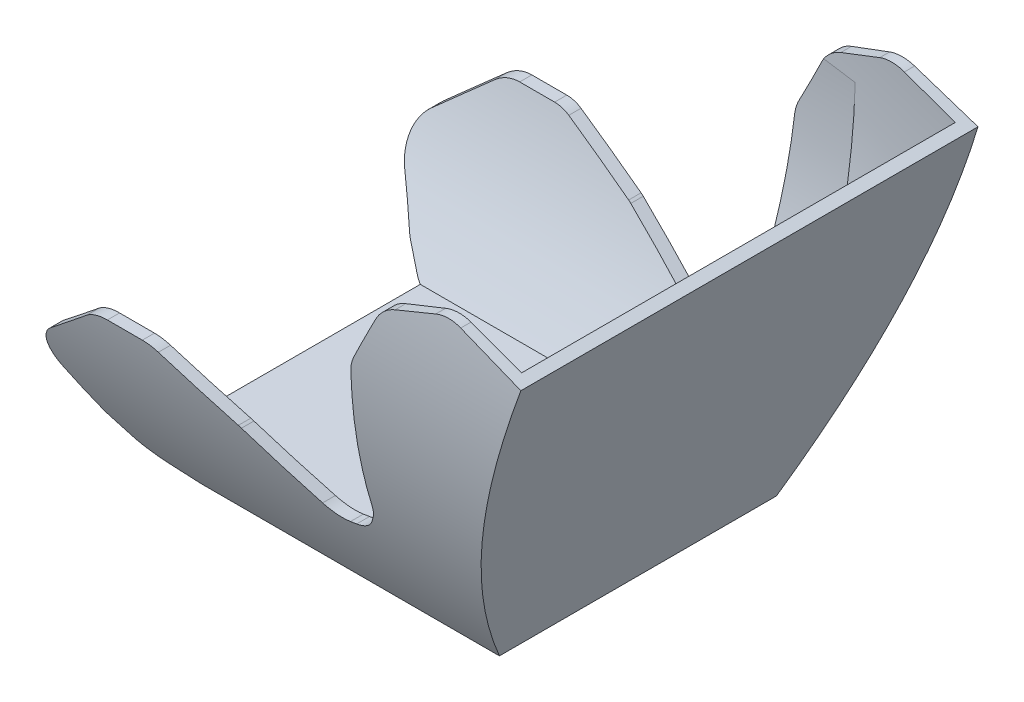
from build123d import *

# Parameters (mm, degrees)
Y_KSEKLIK_EKSTR_ZYON1_DEPTH = 250
KES_EKSTR_ZYON13_DEPTH      = 500
KES_EKSTR_ZYON14_DEPTH      = 1000
IZIM15_R                    = 5
Y_KSEKLIK_EKSTR_ZYON4_DEPTH = 8
KES_EKSTR_ZYON16_START      = -10
KES_EKSTR_ZYON16_DEPTH      = 398


with BuildPart() as part:
    # Çizim2 → Yükseklik-Ekstrüzyon1 (new, symmetric)
    with BuildSketch(Plane.XY):
        with BuildLine():
            Line((-251.598347714, 0), (0, 0))
            Line((0, 0), (94.770919234, 280.870869409))
            Line((94.770919234, 280.870869409), (42.271596492, 300.037816277))
            ThreePointArc((42.271596492, 300.037816277), (31.625623132, 301.855057422), (21.025984571, 299.784604201))
            Line((21.025984571, 299.784604201), (-12.44122247, 286.653935956))
            ThreePointArc((-12.44122247, 286.653935956), (-21.685117037, 280.905727888), (-28.269396883, 272.237467295))
            Line((-28.269396883, 272.237467295), (-47.268412194, 234.572083159))
            ThreePointArc((-47.268412194, 234.572083159), (-49.490308525, 228.714918742), (-50.447386388, 222.524022177))
            Line((-50.447386388, 222.524022177), (-55.990395454, 108.986552763))
            ThreePointArc((-55.990395454, 108.986552763), (-57.106750726, 102.215641855), (-59.732542728, 95.875555108))
            Line((-59.732542728, 95.875555108), (-62.512116759, 90.874386918))
            ThreePointArc((-62.512116759, 90.874386918), (-70.477702775, 81.642865284), (-81.459104145, 76.343773268))
            Line((-81.459104145, 76.343773268), (-87.335030472, 74.874983012))
            ThreePointArc((-87.335030472, 74.874983012), (-98.838790637, 74.278991376), (-109.719108658, 78.061898157))
            Line((-109.719108658, 78.061898157), (-166.235737603, 111.008804426))
            ThreePointArc((-166.235737603, 111.008804426), (-167.345789278, 111.624826846), (-168.480909755, 112.193333524))
            Line((-168.480909755, 112.193333524), (-227.9998591, 140.443369885))
            ThreePointArc((-227.9998591, 140.443369885), (-234.270789173, 142.607877162), (-240.864104601, 143.341257956))
            Line((-240.864104601, 143.341257956), (-270.544956688, 143.340747158))
            ThreePointArc((-270.544956688, 143.340747158), (-280.927841245, 141.486528141), (-290.027309538, 136.153414917))
            Line((-290.027309538, 136.153414917), (-332.246207759, 100.096901135))
            ThreePointArc((-332.246207759, 100.096901135), (-342.456224595, 81.565882872), (-337.897558117, 60.905252638))
            Line((-337.897558117, 60.905252638), (-319.153714319, 32.14205353))
            ThreePointArc((-319.153714319, 32.14205353), (-317.426252372, 29.756074883), (-315.473122783, 27.551011689))
            Line((-315.473122783, 27.551011689), (-302.684297046, 14.467253273))
            ThreePointArc((-302.684297046, 14.467253273), (-297.840926945, 10.455295678), (-292.267553772, 7.541269399))
            Line((-292.267553772, 7.541269399), (-287.337625955, 5.590773548))
            ThreePointArc((-287.337625955, 5.590773548), (-283.96923548, 4.483431985), (-280.493722449, 3.781243338))
            Line((-280.493722449, 3.781243338), (-255.791328898, 0.294463331))
            ThreePointArc((-255.791328898, 0.294463331), (-253.700001816, 0.073706377), (-251.598347714, 0))
        make_face()
    extrude(amount=Y_KSEKLIK_EKSTR_ZYON1_DEPTH, both=True)

    # Çizim13 → Kes-Ekstrüzyon13 (cut, symmetric)
    with BuildSketch(Plane(origin=(0, 0, 0), x_dir=(0, 0, -1), z_dir=(1, 0, 0))):
        Polygon((294.881715038, 462.49790849), (-269.886941457, 462.49790849), (-294.112942808, -53.818745303), (294.881715038, -53.818745303), align=None)
        with BuildLine():
            Line((117.717370471, 0), (-117.717370471, 0))
            add(Edge.make_bspline(
                [(-176.716004976, 388.305779353), (-213.790379898, 252.136745213), (-194.124168396, 122.70148543), (-117.717370471, 0)],
                knots=[0.063181562, 0.063181562, 0.063181562, 0.063181562, 1, 1, 1, 1], degree=3))
            Line((-176.716004976, 388.305779353), (176.716004976, 388.305779353))
            add(Edge.make_bspline(
                [(176.716004976, 388.305779353), (213.790379898, 252.136745214), (194.124168396, 122.70148543), (117.717370471, 0)],
                knots=[0.063181562, 0.063181562, 0.063181562, 0.063181562, 1, 1, 1, 1], degree=3))
        make_face(mode=Mode.SUBTRACT)
    extrude(amount=KES_EKSTR_ZYON13_DEPTH, both=True, mode=Mode.SUBTRACT)

    # Çizim13<3> → Kes-Ekstrüzyon14 (cut)
    with BuildSketch(Plane(origin=(0, 0, 0), x_dir=(0, 0, -1), z_dir=(1, 0, 0))):
        with BuildLine():
            Line((169.019924374, 378.305779353), (-169.019924374, 378.305779353))
            add(Edge.make_bspline(
                [(-112.133649161, 10), (-113.24578432, 11.823775225), (-115.454274312, 15.490392711), (-119.757397172, 22.816603417), (-124.946316144, 31.999559087), (-130.862064414, 43.047432937), (-138.338218725, 57.820092835), (-146.91156559, 76.363289483), (-155.968024634, 98.740969277), (-163.795789649, 121.246412315), (-172.598208489, 151.427747374), (-180.542606024, 189.48885585), (-184.419921192, 228.022624838), (-185.082491018, 259.151084736), (-184.358936213, 282.652164676), (-182.413337197, 306.312811619), (-179.24466472, 330.133106378), (-175.580266325, 350.129347559), (-172.039236622, 366.19151893), (-170.055020129, 374.284528287), (-169.019924374, 378.305779353)],
                knots=[0.080413288, 0.080413288, 0.080413288, 0.080413288, 0.094591345, 0.108769402, 0.137125516, 0.16548163, 0.193837744, 0.250549971, 0.307262199, 0.363974427, 0.420686654, 0.53411111, 0.647535565, 0.704247793, 0.760960021, 0.817672248, 0.874384476, 0.931096704, 0.959452817, 0.987808931, 0.987808931, 0.987808931, 0.987808931], degree=3))
            Line((-112.133649161, 10), (112.133649161, 10))
            add(Edge.make_bspline(
                [(169.019924374, 378.305779353), (170.055020129, 374.284528287), (172.039236622, 366.191518931), (175.580266325, 350.129347559), (179.24466472, 330.133106379), (182.413337197, 306.312811619), (184.358936213, 282.652164677), (185.082491018, 259.151084736), (184.419921192, 228.022624839), (180.542606024, 189.48885585), (172.598208489, 151.427747374), (163.795789649, 121.246412315), (155.968024634, 98.740969277), (146.91156559, 76.363289483), (138.338218725, 57.820092835), (130.862064414, 43.047432937), (124.946316144, 31.999559087), (119.757397172, 22.816603417), (115.454274312, 15.490392711), (113.24578432, 11.823775225), (112.133649161, 10)],
                knots=[0.080413288, 0.080413288, 0.080413288, 0.080413288, 0.108769402, 0.137125516, 0.193837744, 0.250549971, 0.307262199, 0.363974427, 0.420686654, 0.53411111, 0.647535565, 0.704247793, 0.76096002, 0.817672248, 0.874384476, 0.90274059, 0.931096704, 0.959452817, 0.973630874, 0.987808931, 0.987808931, 0.987808931, 0.987808931], degree=3))
        make_face()
    extrude(amount=-KES_EKSTR_ZYON14_DEPTH, mode=Mode.SUBTRACT)

    # Çizim15 → Yükseklik-Ekstrüzyon4 (add)
    with BuildSketch(Plane.XZ):
        with Locations((-138.39689843, 70)):
            Circle(IZIM15_R)
        with Locations((-38.39689843, 70)):
            Circle(IZIM15_R)
        with Locations((-38.39689843, -70)):
            Circle(IZIM15_R)
        with Locations((-138.39689843, -70)):
            Circle(IZIM15_R)
    extrude(amount=Y_KSEKLIK_EKSTR_ZYON4_DEPTH)

    # Çizim14 → Kes-Ekstrüzyon16 (cut)
    with BuildSketch(Plane(origin=(0, 0, 0), x_dir=(0, 0, -1), z_dir=(0.9475157845231127, -0.3197089896758463, 0)).offset(KES_EKSTR_ZYON16_START)):
        with BuildLine():
            Line((-180.149552839, 340.746536743), (180.148355649, 340.746536743))
            add(Edge.make_bspline(
                [(111.977053548, 10), (124.094061485, 30.964809424), (134.955197282, 52.547090628), (146.743934895, 80.403887715), (149.012703978, 86.021411636), (153.351272845, 97.310630145), (159.566285628, 114.338359308), (164.885223488, 131.653421278), (168.799330149, 146.248849499), (169.556229905, 149.176247081), (171.017653717, 155.047836887), (171.722600409, 157.993924027), (173.754245509, 166.840727827), (177.485172275, 184.567814179), (180.221424184, 202.395093478), (186.434352994, 255.929697006), (185.913439502, 298.073995951), (180.148355649, 340.746536743)],
                knots=[0, 0, 0, 0, 0.25, 0.25, 0.3125, 0.3125, 0.375, 0.5, 0.5, 0.53125, 0.53125, 0.5625, 0.5625, 0.625, 0.75, 0.75, 1.185964272, 1.185964272, 1.185964272, 1.185964272], degree=3))
            Line((111.977053548, 10), (-111.977053548, 10))
            add(Edge.make_bspline(
                [(-180.149552839, 340.746536743), (-185.887185925, 298.257545956), (-186.467560816, 256.02829459), (-180.87653343, 208.067430578), (-180.063419635, 202.063130804), (-178.219178745, 190.113193897), (-175.124191733, 172.259364887), (-170.374517239, 151.676213673), (-166.317386759, 137.117684536), (-164.641630906, 131.305715076), (-163.776770395, 128.403753718), (-161.107750411, 119.729461228), (-159.22967995, 113.989808547), (-153.308233155, 96.896566372), (-148.977868959, 85.668584401), (-134.905355723, 52.457949683), (-124.084109814, 30.947591072), (-111.977053548, 10)],
                knots=[-0.186496921, -0.186496921, -0.186496921, -0.186496921, 0.25, 0.25, 0.3125, 0.3125, 0.375, 0.5, 0.53125, 0.53125, 0.5625, 0.5625, 0.625, 0.625, 0.75, 0.75, 1, 1, 1, 1], degree=3))
        make_face()
    extrude(amount=-KES_EKSTR_ZYON16_DEPTH, mode=Mode.SUBTRACT)


solid = part.part
